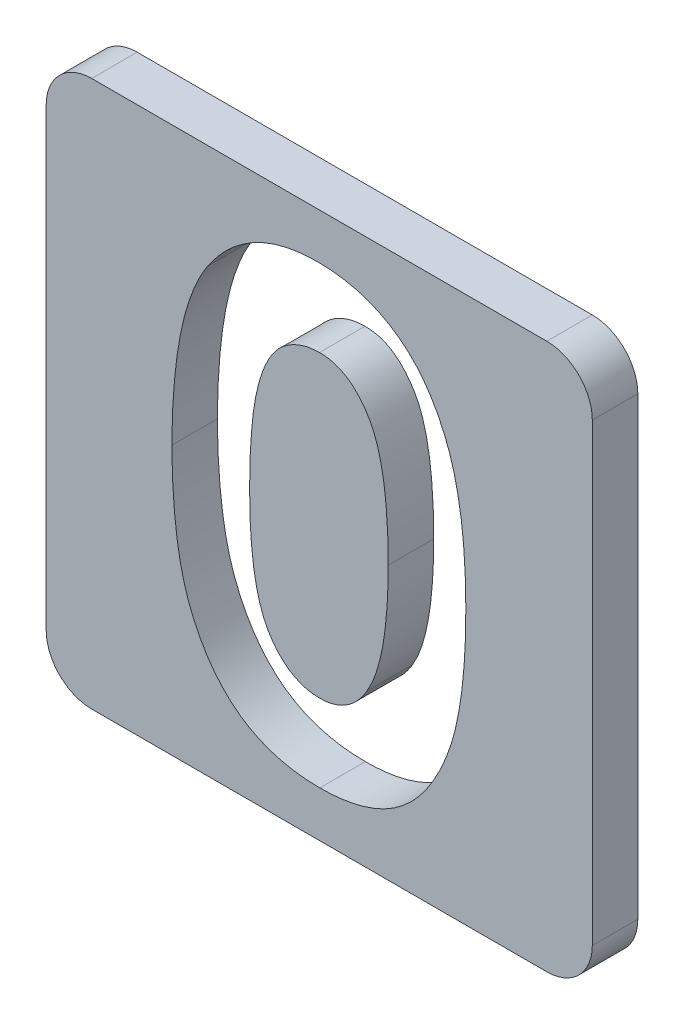
from build123d import *

# Parameters (mm, degrees)
BOSS_EXTRUDE1_DEPTH = 10
CUT_EXTRUDE9_DEPTH  = 10


with BuildPart() as part:
    # Sketch1 → Boss-Extrude1 (new body)
    with BuildSketch(Plane.XY):
        with BuildLine():
            Line((-50, 60), (50, 60))
            ThreePointArc((50, 60), (57.071067812, 57.071067812), (60, 50))
            Line((60, 50), (60, -50))
            ThreePointArc((60, -50), (57.071067812, -57.071067812), (50, -60))
            Line((50, -60), (-50, -60))
            ThreePointArc((-50, -60), (-57.071067812, -57.071067812), (-60, -50))
            Line((-60, -50), (-60, 50))
            ThreePointArc((-60, 50), (-57.071067812, 57.071067812), (-50, 60))
        make_face()
    extrude(amount=BOSS_EXTRUDE1_DEPTH)

    # Sketch2 → Cut-Extrude9 (cut)
    with BuildSketch(Plane.XY.offset(10)):
        with BuildLine():
            add(Edge.make_bspline(
                [(-0.355969551, 49.935897436), (0.469383272, 49.923644841), (2.092247439, 49.899552965), (4.482420878, 49.638618324), (6.78481874, 49.244418855), (9.008448293, 48.694648055), (11.137303626, 47.967045984), (13.186878987, 47.096118777), (15.132778499, 46.036184508), (16.999818598, 44.838934314), (18.787280098, 43.483477371), (20.452202613, 41.938186469), (22.024991165, 40.238618816), (23.471600674, 38.359079999), (24.824066748, 36.316666414), (26.077945411, 34.111054202), (27.223637911, 31.731448367), (28.273984728, 29.173554722), (29.213208168, 26.399031546), (30.004314908, 23.376053852), (30.682821314, 20.103931296), (31.255528594, 16.574519064), (31.688402734, 12.783125727), (31.980168618, 8.732270097), (32.180392178, 4.429761628), (32.19673303, 1.47827617), (32.205128205, -0.038060897)],
                knots=[0, 0, 0, 0, 0.879237366, 1.728815576, 2.559023295, 3.367336655, 4.166867292, 4.954216142, 5.737608147, 6.525189134, 7.316157332, 8.124696809, 8.942788509, 9.781158001, 10.649253743, 11.551476218, 12.482711956, 13.461909668, 14.496590415, 15.601789533, 16.789733467, 18.056700938, 19.410929216, 20.8549011, 22.384193279, 24, 24, 24, 24], degree=3))
            add(Edge.make_bspline(
                [(32.205128205, -0.038060897), (32.196055289, -1.573369046), (32.178426775, -4.556445238), (31.98849197, -8.898306638), (31.661415261, -12.97857391), (31.239855194, -16.796824928), (30.662433215, -20.351043334), (29.986191811, -23.650432162), (29.182597691, -26.693795466), (28.212436531, -29.474275901), (27.168447487, -32.036661767), (26.019621026, -34.411627937), (24.785981031, -36.605607132), (23.495823484, -38.651698514), (22.078417204, -40.489584347), (20.602751349, -42.181762361), (19.004572794, -43.663775323), (17.351171034, -45.011999532), (15.581975276, -46.177135811), (13.715230768, -47.19614479), (11.717656699, -48.022682101), (9.625665447, -48.741560107), (7.403598595, -49.257636949), (5.086764482, -49.667126963), (2.649006517, -49.893436261), (0.989282707, -49.921511419), (0.138822115, -49.935897436)],
                knots=[0, 0, 0, 0, 1.643780988, 3.193836972, 4.651895693, 6.025988579, 7.305620092, 8.505800249, 9.631074763, 10.672816429, 11.65661981, 12.592235626, 13.49536222, 14.350718032, 15.179365177, 15.97804903, 16.751647189, 17.51006938, 18.259804725, 19.016521909, 19.783502495, 20.571750527, 21.382245291, 22.22305063, 23.089471752, 24, 24, 24, 24], degree=3))
            add(Edge.make_bspline(
                [(0.138822115, -49.935897436), (-0.711615522, -49.921233922), (-2.377610346, -49.892508314), (-4.82196025, -49.668809668), (-7.151072419, -49.255978097), (-9.390719391, -48.73759805), (-11.525313574, -48.02427269), (-13.565090283, -47.173005975), (-15.494365399, -46.160355104), (-17.318480783, -44.992504168), (-19.031208385, -43.653300599), (-20.659163982, -42.157068682), (-22.198746442, -40.50760098), (-23.626534898, -38.686422088), (-24.965912393, -36.717840949), (-26.202911339, -34.579377322), (-27.33678833, -32.27414476), (-28.403011249, -29.798930006), (-29.329424003, -27.100444523), (-30.153888339, -24.15459118), (-30.829267837, -20.936813858), (-31.372453222, -17.448146304), (-31.806132121, -13.695979411), (-32.128739375, -9.678502118), (-32.319729182, -5.393843179), (-32.337172823, -2.448783662), (-32.346153846, -0.932491987)],
                knots=[0, 0, 0, 0, 0.917216111, 1.796812873, 2.643793957, 3.46689424, 4.273913431, 5.068098542, 5.848489301, 6.620921603, 7.401012384, 8.190319798, 9.003608147, 9.831726257, 10.68377682, 11.569763213, 12.493818149, 13.453288342, 14.474581811, 15.568529029, 16.750744269, 18.018426408, 19.375425659, 20.823733699, 22.36466933, 24, 24, 24, 24], degree=3))
            add(Edge.make_bspline(
                [(-32.346153846, -0.932491987), (-32.329885562, 1.174275928), (-32.298495698, 5.239311758), (-31.900700289, 11.112106626), (-31.31683752, 16.540488165), (-30.459281419, 21.515376031), (-29.398925159, 26.055195758), (-28.041083756, 30.130041389), (-26.495280093, 33.796297553), (-25.178056781, 35.968209776), (-24.543669872, 37.014222756)],
                knots=[0, 0, 0, 0, 1.288568992, 2.486310467, 3.599230591, 4.627010532, 5.572937695, 6.447898582, 7.252493626, 8, 8, 8, 8], degree=3))
            add(Edge.make_bspline(
                [(-24.543669872, 37.014222756), (-23.806034991, 38.041825582), (-22.363813448, 40.050991593), (-19.842048768, 42.688651004), (-17.132740948, 44.944506494), (-14.180242351, 46.767506031), (-11.031247971, 48.205123615), (-7.658722091, 49.220496723), (-4.075118883, 49.812100409), (-1.614198783, 49.894015537), (-0.355969551, 49.935897436)],
                knots=[0, 0, 0, 0, 1.058512271, 2.069600068, 3.047294572, 4.004278952, 4.967380941, 5.939006123, 6.946246673, 8, 8, 8, 8], degree=3))
        make_face()
        with BuildLine():
            add(Edge.make_bspline(
                [(0.062700321, 32.884615385), (-0.683425475, 32.849250505), (-2.146228103, 32.779916569), (-4.268824412, 32.191369271), (-6.270300203, 31.282326235), (-7.79276938, 30.188435071), (-8.932322417, 29.139809208), (-9.728536295, 28.190836906), (-10.49635909, 27.13185221), (-11.174538847, 25.915068584), (-11.814917568, 24.584206505), (-12.440760604, 23.133224653), (-12.953787556, 21.526483777), (-13.457822935, 19.791346881), (-13.899404957, 17.879842038), (-14.269353885, 15.776344805), (-14.599870734, 13.467175948), (-14.830410177, 10.950822957), (-15.045342122, 8.229918558), (-15.199415519, 5.298401631), (-15.263829739, 2.157063038), (-15.28430506, -0.006330233), (-15.294871795, -1.122796474)],
                knots=[0, 0, 0, 0, 1.076674018, 2.110852608, 3.161083442, 4.239746716, 4.804137807, 5.395870207, 6.026861976, 6.692161227, 7.405688833, 8.16177676, 8.973626916, 9.841385931, 10.773283133, 11.807421078, 12.927755683, 14.143907515, 15.458935494, 16.872852025, 18.386167141, 20, 20, 20, 20], degree=3))
            add(Edge.make_bspline(
                [(-15.294871795, -1.122796474), (-15.277480231, -2.569232463), (-15.244130617, -5.342880716), (-15.069460926, -9.33148348), (-14.719350027, -12.961433168), (-14.283882757, -16.257331292), (-13.672251194, -19.19780307), (-12.968529489, -21.810668093), (-12.099495755, -24.062618675), (-11.095159828, -25.986223088), (-9.982812536, -27.622629365), (-8.775310618, -29.01358207), (-7.513765188, -30.218081489), (-6.158799311, -31.196481524), (-4.71364553, -31.94628221), (-3.19036822, -32.485604584), (-1.587999362, -32.815746269), (-0.490713686, -32.861526307), (0.062700321, -32.884615385)],
                knots=[0, 0, 0, 0, 1.771748488, 3.397459088, 4.888034009, 6.237357457, 7.467047327, 8.564189669, 9.548206622, 10.417051504, 11.216568818, 11.965764335, 12.669334354, 13.348544111, 14.005342236, 14.656555988, 15.322436492, 16, 16, 16, 16], degree=3))
            add(Edge.make_bspline(
                [(0.062700321, -32.884615385), (0.597122912, -32.868816122), (1.643455894, -32.837883131), (3.169243716, -32.520360132), (4.612137098, -32.004136701), (5.967779494, -31.273902417), (7.241019849, -30.345297795), (8.425635348, -29.214242154), (9.51269186, -27.869461502), (10.146015918, -26.871435372), (10.472355769, -26.357171474)],
                knots=[0, 0, 0, 0, 0.992283464, 1.942767638, 2.88273346, 3.832339453, 4.79467288, 5.803907806, 6.868395428, 8, 8, 8, 8], degree=3))
            add(Edge.make_bspline(
                [(10.472355769, -26.357171474), (10.856565983, -25.654446294), (11.662223642, -24.18088858), (12.594532076, -21.694314882), (13.379297353, -18.889870725), (14.054733351, -15.758828412), (14.516690372, -12.288838726), (14.914527194, -8.501905171), (15.106413779, -4.378958283), (15.137625178, -1.522565806), (15.153846154, -0.038060897)],
                knots=[0, 0, 0, 0, 0.710965849, 1.490837728, 2.352621235, 3.297892224, 4.334225155, 5.461620853, 6.680770821, 8, 8, 8, 8], degree=3))
            add(Edge.make_bspline(
                [(15.153846154, -0.038060897), (15.147580341, 1.45933023), (15.135519722, 4.341552532), (14.914242276, 8.479321703), (14.606096526, 12.258487118), (14.15536825, 15.670611435), (13.575424398, 18.723977801), (12.860641413, 21.418386611), (12.017965444, 23.759148028), (11.01865217, 25.743927991), (9.91185063, 27.430718692), (8.736947008, 28.877854275), (7.488973334, 30.113382125), (6.170016624, 31.14195175), (4.749549166, 31.927856087), (3.254703739, 32.482769565), (1.682415797, 32.818473609), (0.609892831, 32.862270544), (0.062700321, 32.884615385)],
                knots=[0, 0, 0, 0, 1.793836731, 3.452829483, 4.963243077, 6.335886805, 7.574563692, 8.684454726, 9.672768357, 10.54971625, 11.340229787, 12.085688095, 12.778991901, 13.440269426, 14.083255152, 14.715733572, 15.344777694, 16, 16, 16, 16], degree=3))
        make_face(mode=Mode.SUBTRACT)
    extrude(amount=-CUT_EXTRUDE9_DEPTH, mode=Mode.SUBTRACT)


with BuildPart() as cut_extrude9_piece_1:
    # of the separate pieces the step leaves, piece 1, a body of its own (cut_extrude9_pieces)
    add(part.part.solids().sort_by_distance((-50, 60, 0))[0])


with BuildPart() as cut_extrude9_piece_2:
    # of the separate pieces the step leaves, piece 2, a body of its own (cut_extrude9_pieces)
    add(part.part.solids().sort_by_distance((0.062700321, 32.884615385, 0))[0])


solid = Compound([cut_extrude9_piece_1.part, cut_extrude9_piece_2.part])
